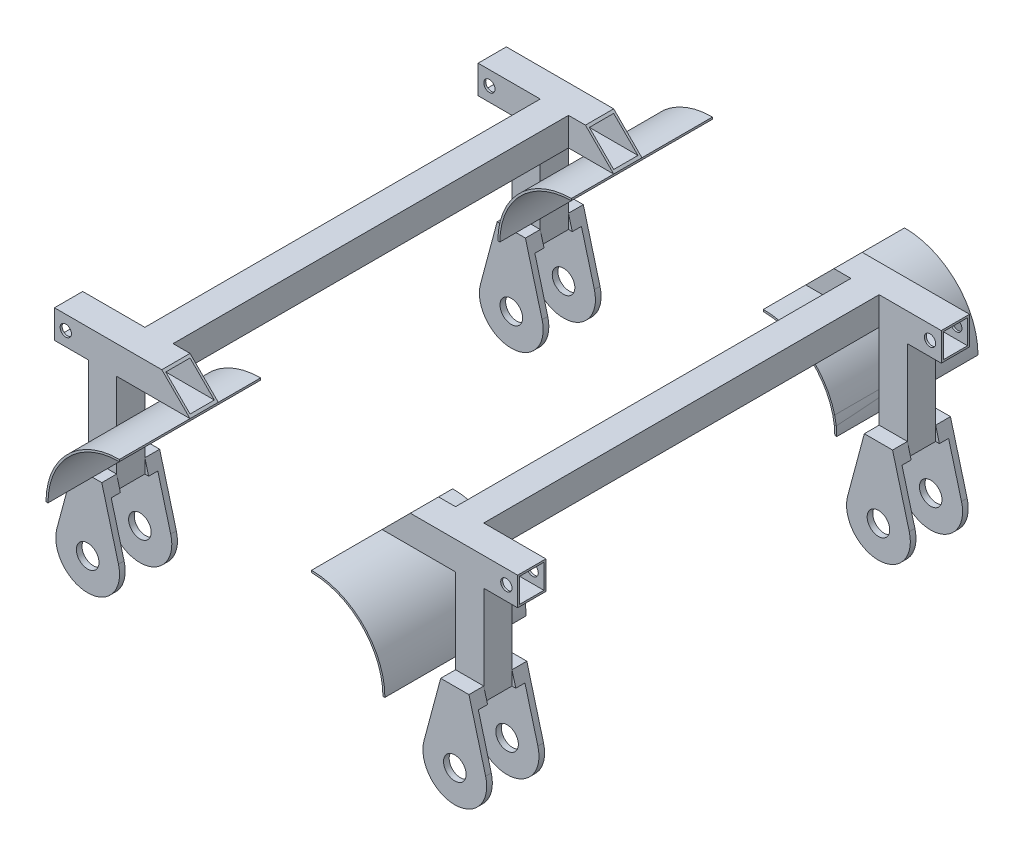
from build123d import *

# Parameters (mm, degrees)
BOSS_EXTRUDE1_DEPTH      = 4
BOSS_EXTRUDE1_DEPTH_BACK = 1.25
SKETCH1_R                = 4
SKETCH2_W                = 10
SKETCH2_H                = 35
BOSS_EXTRUDE2_DEPTH      = 10
SKETCH4_W                = 10
SKETCH4_H                = 10
SKETCH4_W_2              = 8.6
SKETCH4_H_2              = 8.6
BOSS_EXTRUDE3_DEPTH      = 48
SKETCH5_R                = 2
CUT_EXTRUDE1_DEPTH       = 50
BOSS_EXTRUDE4_DEPTH      = 25
CUT_EXTRUDE2_DEPTH       = 50
SKETCH11_W               = 10
SKETCH11_H               = 10
BOSS_EXTRUDE5_DEPTH      = 140
CUT_EXTRUDE5_START       = -44
SKETCH16_W               = 3.25
SKETCH16_H               = 33.738190003
SKETCH16_H_2             = 35.994544039
CUT_EXTRUDE5_DEPTH       = 80


with BuildPart() as part:
    # Sketch1 → Boss-Extrude1 (new, two sides: drawn at the far end of the back side and taken through both)
    with BuildSketch(Plane.XY.offset(-BOSS_EXTRUDE1_DEPTH_BACK)):
        with BuildLine():
            Line((-5, 25), (5, 25))
            Line((5, 25), (10.908860009, 2.919234199))
            ThreePointArc((10.908860009, 2.919234199), (0, -11.292703618), (-10.908860009, 2.919234199))
            Line((-10.908860009, 2.919234199), (-5, 25))
        make_face()
        Circle(SKETCH1_R, mode=Mode.SUBTRACT)
    extrude(amount=BOSS_EXTRUDE1_DEPTH + BOSS_EXTRUDE1_DEPTH_BACK)

    # Sketch2 → Boss-Extrude2 (add)
    with BuildSketch(Plane.XY.offset(4)):
        with Locations((0, 37.5)):
            Rectangle(SKETCH2_W, SKETCH2_H)
    extrude(amount=BOSS_EXTRUDE2_DEPTH)

    # Mirror1: part across plane


with BuildPart() as part_1:
    add(part.part)
    add(part.part.mirror(Plane.XY.offset(9)))

    # Sketch4 → Boss-Extrude3 (add)
    with BuildSketch(Plane(origin=(17, 0, 0), x_dir=(0, 0, -1), z_dir=(1, 0, 0))):
        with Locations((-9, 60)):
            Rectangle(SKETCH4_W, SKETCH4_H)
        with Locations((-9, 60)):
            Rectangle(SKETCH4_W_2, SKETCH4_H_2, mode=Mode.SUBTRACT)
    extrude(amount=-BOSS_EXTRUDE3_DEPTH)

    # Sketch5 → Cut-Extrude1 (cut)
    with BuildSketch(Plane.XY.offset(14)):
        with Locations((13, 60)):
            Circle(SKETCH5_R)
    extrude(amount=-CUT_EXTRUDE1_DEPTH, mode=Mode.SUBTRACT)

    # Sketch10 → Cut-Extrude2 (cut)
    with BuildSketch(Plane.XY.offset(14)):
        Polygon((-31, 65), (-31, 55), (-21, 65), align=None)
    extrude(amount=-CUT_EXTRUDE2_DEPTH, mode=Mode.SUBTRACT)


with BuildPart() as body_2:
    # Sketch9 → Boss-Extrude4 (new, symmetric)
    with BuildSketch(Plane.XY.offset(14)):
        with BuildLine():
            ThreePointArc((-5.7, 29), (-13.110198436, 46.889801564), (-31, 54.3))
            Line((-31, 54.3), (-31, 55))
            ThreePointArc((-31, 55), (-12.615223689, 47.384776311), (-5, 29))
            Line((-5, 29), (-5.7, 29))
        make_face()
    extrude(amount=BOSS_EXTRUDE4_DEPTH, both=True)


with BuildPart() as body_3:
    # Mirror2: mirrored copy
    add(part_1.part.mirror(Plane(origin=(0, 0, -66), x_dir=(1, 0, 0), z_dir=(0, 0, -1))))


with BuildPart() as body_4:
    # Mirror2 2: mirrored copy
    add(body_2.part.mirror(Plane(origin=(0, 0, -66), x_dir=(1, 0, 0), z_dir=(0, 0, -1))))


with BuildPart() as part_2:
    add(part_1.part)

    add(body_3.part)  # Boss-Extrude5 merges body 3
    # Sketch11 → Boss-Extrude5 (add)
    with BuildSketch(Plane.XY.offset(-136)):
        with Locations((-10, 60)):
            Rectangle(SKETCH11_W, SKETCH11_H)
    extrude(amount=BOSS_EXTRUDE5_DEPTH)

    # Sketch16 → Cut-Extrude5 (cut)
    with BuildSketch(Plane.ZY.offset(5).offset(CUT_EXTRUDE5_START)):
        with Locations((15.625, 3.130904998)):
            Rectangle(SKETCH16_W, SKETCH16_H)
        with Locations((2.375, 2.00272798)):
            Rectangle(SKETCH16_W, SKETCH16_H_2)
    cut_extrude5 = extrude(amount=CUT_EXTRUDE5_DEPTH, mode=Mode.SUBTRACT)

    # Mirror8: Cut-Extrude5 across plane
    add(cut_extrude5.mirror(Plane(origin=(0, 0, -66), x_dir=(1, 0, 0), z_dir=(0, 0, -1))), mode=Mode.SUBTRACT)


with BuildPart() as body_4_2:
    # Mirror7: mirrored copy
    add(body_2.part.mirror(Plane(origin=(0, 0, -66), x_dir=(1, 0, 0), z_dir=(0, 0, -1))))


with BuildPart() as body_5:
    # Mirror9: mirrored copy
    add(part_2.part.mirror(Plane.ZY.offset(65)))


with BuildPart() as body_6:
    # Mirror9 2: mirrored copy
    add(body_2.part.mirror(Plane.ZY.offset(65)))


with BuildPart() as body_7:
    # Mirror9 3: mirrored copy
    add(body_4_2.part.mirror(Plane.ZY.offset(65)))


solid = Compound([body_2.part, body_4.part, part_2.part, body_4_2.part, body_5.part, body_6.part, body_7.part])
